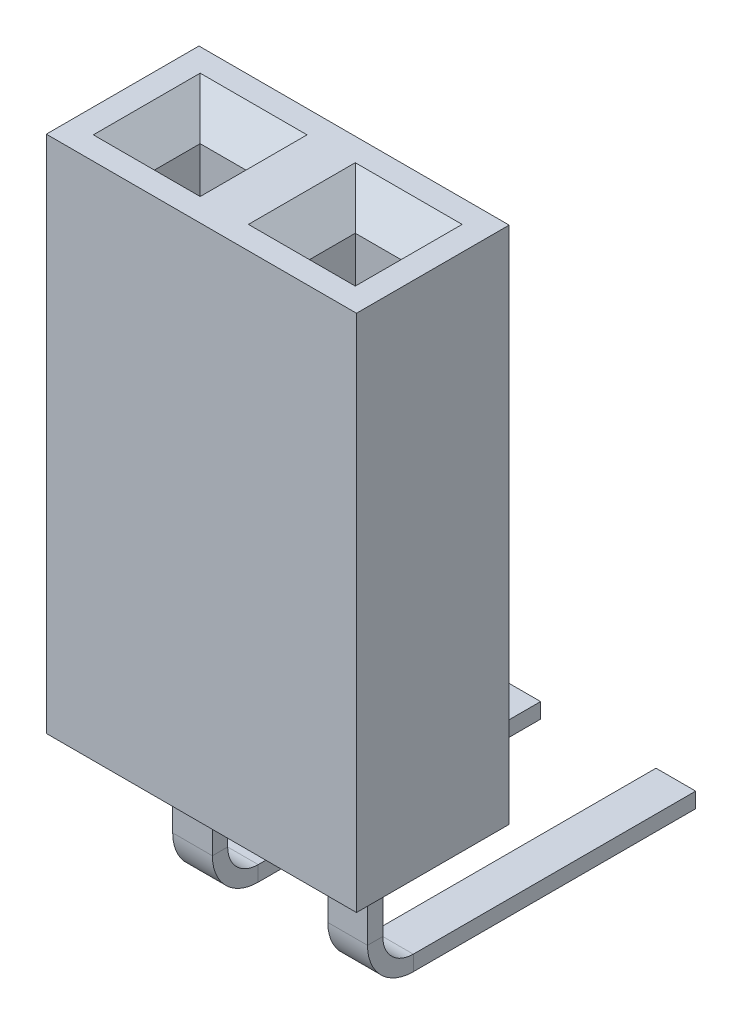
from build123d import *

# Parameters (mm, degrees)
SKETCH1_W           = 5.08
SKETCH1_H           = 2.5
SKETCH1_W_2         = 0.75
SKETCH1_H_2         = 0.75
BOSS_EXTRUDE1_DEPTH = 8.5
CHAMFER1_SIZE       = 0.5
SKETCH2_W           = 0.65
SKETCH2_H           = 0.25


with BuildPart() as part:
    # Sketch1 → Boss-Extrude1 (new body)
    with BuildSketch(Plane(origin=(0, 0, 0), x_dir=(1, 0, 0), z_dir=(0, 1, 0))):
        Rectangle(SKETCH1_W, SKETCH1_H)
        with Locations((-1.27, 0)):
            Rectangle(SKETCH1_W_2, SKETCH1_H_2, mode=Mode.SUBTRACT)
        with Locations((1.27, 0)):
            Rectangle(SKETCH1_W_2, SKETCH1_H_2, mode=Mode.SUBTRACT)
    extrude(amount=BOSS_EXTRUDE1_DEPTH)

    # Chamfer1
    chamfer1_edges = [part.edges().sort_by_distance(p)[0] for p in [
        (-0.895, 8.5, 0),
        (-1.27, 8.5, -0.375),
        (-1.645, 8.5, 0),
        (-1.27, 8.5, 0.375),
        (1.645, 8.5, 0),
        (1.27, 8.5, -0.375),
        (0.895, 8.5, 0),
        (1.27, 8.5, 0.375),
    ]]
    chamfer(chamfer1_edges, length=CHAMFER1_SIZE)


with BuildPart() as body_2:
    # Sweep1: sweep along a path in Sketch3
    with BuildLine(Plane.ZY.offset(2.54)) as sweep1_path:
        Line((-0.125, 0), (-0.125, -1.5))
        ThreePointArc((-0.125, -1.5), (-0.271446609, -1.853553391), (-0.625, -2))
        Line((-0.625, -2), (-5.25, -2))
    # Sketch2 → Sweep1 (sweep)
    with BuildSketch(Plane.XZ):
        with Locations((-1.27, 0)):
            Rectangle(SKETCH2_W, SKETCH2_H)
        with Locations((1.27, 0)):
            Rectangle(SKETCH2_W, SKETCH2_H)
    sweep(path=sweep1_path.line)


solid = Compound([part.part, body_2.part])
